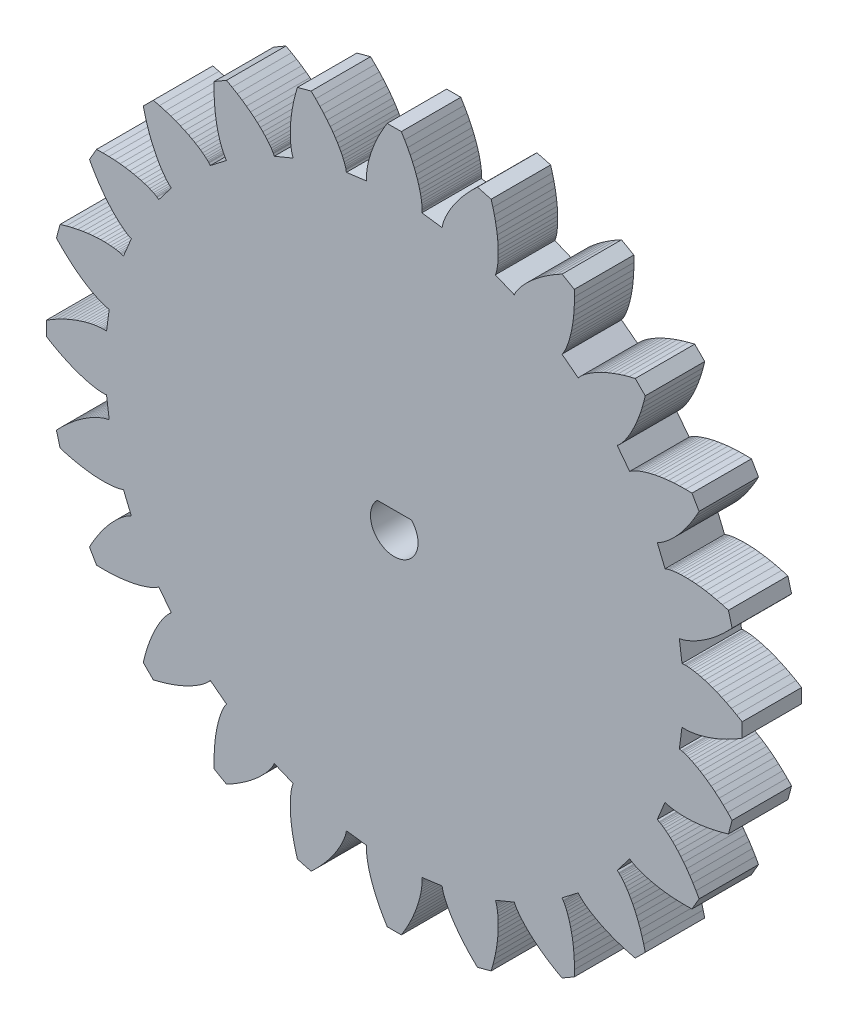
from build123d import *

# Parameters (mm, degrees)
BOSS_EXTRUDE1_DEPTH = 5
CUT_EXTRUDE1_DEPTH  = 5


with BuildPart() as part:
    # Model → Boss-Extrude1 (new body)
    with BuildSketch(Plane.XY):
        Polygon((24.189445795, 2.315321174), (24.358981209, 2.331548455), (24.373475879, 2.332600418), (24.417035513, 2.334422855), (24.489695938, 2.335012462), (24.591389407, 2.332365569), (24.721944663, 2.3244829), (24.881087201, 2.309374327), (25.068439731, 2.285063607), (25.283522858, 2.249593098), (25.525755949, 2.201028446), (25.794458213, 2.137463224), (26.088849976, 2.057023535), (26.408054153, 1.95787255), (26.751097915, 1.838214988), (27.116914554, 1.696301513), (27.504345528, 1.530433068), (27.9121427, 1.338965104), (28.338970755, 1.120311722), (28.783409797, 0.872949713), (29.24395812, 0.595422481), (29.24395812, -0.595422481), (28.783409797, -0.872949713), (28.338970755, -1.120311722), (27.9121427, -1.338965104), (27.504345528, -1.530433068), (27.116914554, -1.696301513), (26.751097915, -1.838214988), (26.408054153, -1.95787255), (26.088849976, -2.057023535), (25.794458213, -2.137463224), (25.525755949, -2.201028446), (25.283522858, -2.249593098), (25.068439731, -2.285063607), (24.881087201, -2.309374327), (24.721944663, -2.3244829), (24.591389407, -2.332365569), (24.489695938, -2.335012462), (24.417035513, -2.334422855), (24.373475879, -2.332600418), (24.358981209, -2.331548455), (24.189445795, -2.315321174), (23.964459632, -4.024260744), (24.132418196, -4.052465388), (24.146691241, -4.055200767), (24.189238298, -4.06471449), (24.25957548, -4.082950876), (24.357118762, -4.111827785), (24.481185271, -4.153232045), (24.630994771, -4.209014926), (24.805671342, -4.280987681), (25.004245246, -4.370917171), (25.225654987, -4.48052156), (25.468749554, -4.611466113), (25.732290837, -4.765359081), (26.014956232, -4.943747698), (26.315341406, -5.148114287), (26.631963235, -5.37987249), (26.963262906, -5.64036362), (27.307609171, -5.930853146), (27.663301753, -6.252527324), (28.028574902, -6.606489966), (28.401601089, -6.993759364), (28.093387733, -8.144027267), (27.57670288, -8.292899311), (27.083385732, -8.416803376), (26.614509831, -8.517535095), (26.171052456, -8.596933272), (25.753892959, -8.656875372), (25.36381131, -8.699272949), (25.001486824, -8.72606702), (24.667497103, -8.739223396), (24.362317173, -8.740727974), (24.086318826, -8.732582), (23.83977017, -8.716797315), (23.62283538, -8.695391586), (23.435574655, -8.670383535), (23.277944382, -8.643788176), (23.149797503, -8.617612063), (23.050884088, -8.593848559), (22.980852109, -8.574473141), (22.939248415, -8.561438739), (22.925519907, -8.556671124), (22.765961201, -8.497117781), (22.106335149, -10.089595943), (22.261270765, -10.160310412), (22.274349499, -10.166646721), (22.312984467, -10.186848261), (22.376205044, -10.222667859), (22.462950725, -10.27580687), (22.572073559, -10.34791109), (22.702340753, -10.440566767), (22.852437444, -10.555296733), (23.020969641, -10.693556658), (23.206467325, -10.856731426), (23.407387701, -11.046131655), (23.622118602, -11.262990351), (23.848982036, -11.50845971), (24.086237868, -11.783608081), (24.332087633, -12.089417074), (24.584678476, -12.426778848), (24.842107204, -12.796493555), (25.102424452, -13.199266966), (25.363638948, -13.635708271), (25.62372188, -14.106328066), (25.028299399, -15.137630054), (24.490689235, -15.147701526), (23.98211273, -15.139703789), (23.5031421, -15.115649145), (23.054245408, -15.07756668), (22.63578612, -15.02749748), (22.24802288, -14.967489835), (21.891109486, -14.899594442), (21.565095068, -14.825859625), (21.269924478, -14.748326558), (21.00543888, -14.669024523), (20.771376543, -14.5899662), (20.567373837, -14.513142998), (20.392966426, -14.440520434), (20.24759066, -14.374033573), (20.130585156, -14.315582537), (20.041192582, -14.267028079), (19.978561612, -14.230187253), (19.941749081, -14.206829158), (19.92972231, -14.198670797), (19.791013975, -14.099849852), (18.741700458, -15.467341852), (18.873054519, -15.575747072), (18.884047648, -15.585252502), (18.916137619, -15.614765157), (18.967933213, -15.665726921), (19.037969718, -15.739506699), (19.124712337, -15.837397095), (19.226559729, -15.960611236), (19.341847699, -16.110279756), (19.468853, -16.28744793), (19.605797266, -16.493072987), (19.750851059, -16.72802158), (19.902138022, -16.993067441), (20.057739126, -17.288889212), (20.215697023, -17.616068457), (20.374020469, -17.975087863), (20.530688836, -18.366329634), (20.683656685, -18.790074076), (20.830858408, -19.246498377), (20.970212914, -19.735675591), (21.099628369, -20.257573822), (20.257573822, -21.099628369), (19.735675591, -20.970212914), (19.246498377, -20.830858408), (18.790074076, -20.683656685), (18.366329634, -20.530688836), (17.975087863, -20.374020469), (17.616068457, -20.215697023), (17.288889212, -20.057739126), (16.993067441, -19.902138022), (16.72802158, -19.750851059), (16.493072987, -19.605797266), (16.28744793, -19.468853), (16.110279756, -19.341847699), (15.960611236, -19.226559729), (15.837397095, -19.124712337), (15.739506699, -19.037969718), (15.665726921, -18.967933213), (15.614765157, -18.916137619), (15.585252502, -18.884047648), (15.575747072, -18.873054519), (15.467341852, -18.741700458), (14.099849852, -19.791013975), (14.198670797, -19.92972231), (14.206829158, -19.941749081), (14.230187253, -19.978561612), (14.267028079, -20.041192582), (14.315582537, -20.130585156), (14.374033573, -20.24759066), (14.440520434, -20.392966426), (14.513142998, -20.567373837), (14.5899662, -20.771376543), (14.669024523, -21.00543888), (14.748326558, -21.269924478), (14.825859625, -21.565095068), (14.899594442, -21.891109486), (14.967489835, -22.24802288), (15.02749748, -22.63578612), (15.07756668, -23.054245408), (15.115649145, -23.5031421), (15.139703789, -23.98211273), (15.147701526, -24.490689235), (15.137630054, -25.028299399), (14.106328066, -25.62372188), (13.635708271, -25.363638948), (13.199266966, -25.102424452), (12.796493555, -24.842107204), (12.426778848, -24.584678476), (12.089417074, -24.332087633), (11.783608081, -24.086237868), (11.50845971, -23.848982036), (11.262990351, -23.622118602), (11.046131655, -23.407387701), (10.856731426, -23.206467325), (10.693556658, -23.020969641), (10.555296733, -22.852437444), (10.440566767, -22.702340753), (10.34791109, -22.572073559), (10.27580687, -22.462950725), (10.222667859, -22.376205044), (10.186848261, -22.312984467), (10.166646721, -22.274349499), (10.160310412, -22.261270765), (10.089595943, -22.106335149), (8.497117781, -22.765961201), (8.556671124, -22.925519907), (8.561438739, -22.939248415), (8.574473141, -22.980852109), (8.593848559, -23.050884088), (8.617612063, -23.149797503), (8.643788176, -23.277944382), (8.670383535, -23.435574655), (8.695391586, -23.62283538), (8.716797315, -23.83977017), (8.732582, -24.086318826), (8.740727974, -24.362317173), (8.739223396, -24.667497103), (8.72606702, -25.001486824), (8.699272949, -25.36381131), (8.656875372, -25.753892959), (8.596933272, -26.171052456), (8.517535095, -26.614509831), (8.416803376, -27.083385732), (8.292899311, -27.57670288), (8.144027267, -28.093387733), (6.993759364, -28.401601089), (6.606489966, -28.028574902), (6.252527324, -27.663301753), (5.930853146, -27.307609171), (5.64036362, -26.963262906), (5.37987249, -26.631963235), (5.148114287, -26.315341406), (4.943747698, -26.014956232), (4.765359081, -25.732290837), (4.611466113, -25.468749554), (4.48052156, -25.225654987), (4.370917171, -25.004245246), (4.280987681, -24.805671342), (4.209014926, -24.630994771), (4.153232045, -24.481185271), (4.111827785, -24.357118762), (4.082950876, -24.25957548), (4.06471449, -24.189238298), (4.055200767, -24.146691241), (4.052465388, -24.132418196), (4.024260744, -23.964459632), (2.315321174, -24.189445795), (2.331548455, -24.358981209), (2.332600418, -24.373475879), (2.334422855, -24.417035513), (2.335012462, -24.489695938), (2.332365569, -24.591389407), (2.3244829, -24.721944663), (2.309374327, -24.881087201), (2.285063607, -25.068439731), (2.249593098, -25.283522858), (2.201028446, -25.525755949), (2.137463224, -25.794458213), (2.057023535, -26.088849976), (1.95787255, -26.408054153), (1.838214988, -26.751097915), (1.696301513, -27.116914554), (1.530433068, -27.504345528), (1.338965104, -27.9121427), (1.120311722, -28.338970755), (0.872949713, -28.783409797), (0.595422481, -29.24395812), (-0.595422481, -29.24395812), (-0.872949713, -28.783409797), (-1.120311722, -28.338970755), (-1.338965104, -27.9121427), (-1.530433068, -27.504345528), (-1.696301513, -27.116914554), (-1.838214988, -26.751097915), (-1.95787255, -26.408054153), (-2.057023535, -26.088849976), (-2.137463224, -25.794458213), (-2.201028446, -25.525755949), (-2.249593098, -25.283522858), (-2.285063607, -25.068439731), (-2.309374327, -24.881087201), (-2.3244829, -24.721944663), (-2.332365569, -24.591389407), (-2.335012462, -24.489695938), (-2.334422855, -24.417035513), (-2.332600418, -24.373475879), (-2.331548455, -24.358981209), (-2.315321174, -24.189445795), (-4.024260744, -23.964459632), (-4.052465388, -24.132418196), (-4.055200767, -24.146691241), (-4.06471449, -24.189238298), (-4.082950876, -24.25957548), (-4.111827785, -24.357118762), (-4.153232045, -24.481185271), (-4.209014926, -24.630994771), (-4.280987681, -24.805671342), (-4.370917171, -25.004245246), (-4.48052156, -25.225654987), (-4.611466113, -25.468749554), (-4.765359081, -25.732290837), (-4.943747698, -26.014956232), (-5.148114287, -26.315341406), (-5.37987249, -26.631963235), (-5.64036362, -26.963262906), (-5.930853146, -27.307609171), (-6.252527324, -27.663301753), (-6.606489966, -28.028574902), (-6.993759364, -28.401601089), (-8.144027267, -28.093387733), (-8.292899311, -27.57670288), (-8.416803376, -27.083385732), (-8.517535095, -26.614509831), (-8.596933272, -26.171052456), (-8.656875372, -25.753892959), (-8.699272949, -25.36381131), (-8.72606702, -25.001486824), (-8.739223396, -24.667497103), (-8.740727974, -24.362317173), (-8.732582, -24.086318826), (-8.716797315, -23.83977017), (-8.695391586, -23.62283538), (-8.670383535, -23.435574655), (-8.643788176, -23.277944382), (-8.617612063, -23.149797503), (-8.593848559, -23.050884088), (-8.574473141, -22.980852109), (-8.561438739, -22.939248415), (-8.556671124, -22.925519907), (-8.497117781, -22.765961201), (-10.089595943, -22.106335149), (-10.160310412, -22.261270765), (-10.166646721, -22.274349499), (-10.186848261, -22.312984467), (-10.222667859, -22.376205044), (-10.27580687, -22.462950725), (-10.34791109, -22.572073559), (-10.440566767, -22.702340753), (-10.555296733, -22.852437444), (-10.693556658, -23.020969641), (-10.856731426, -23.206467325), (-11.046131655, -23.407387701), (-11.262990351, -23.622118602), (-11.50845971, -23.848982036), (-11.783608081, -24.086237868), (-12.089417074, -24.332087633), (-12.426778848, -24.584678476), (-12.796493555, -24.842107204), (-13.199266966, -25.102424452), (-13.635708271, -25.363638948), (-14.106328066, -25.62372188), (-15.137630054, -25.028299399), (-15.147701526, -24.490689235), (-15.139703789, -23.98211273), (-15.115649145, -23.5031421), (-15.07756668, -23.054245408), (-15.02749748, -22.63578612), (-14.967489835, -22.24802288), (-14.899594442, -21.891109486), (-14.825859625, -21.565095068), (-14.748326558, -21.269924478), (-14.669024523, -21.00543888), (-14.5899662, -20.771376543), (-14.513142998, -20.567373837), (-14.440520434, -20.392966426), (-14.374033573, -20.24759066), (-14.315582537, -20.130585156), (-14.267028079, -20.041192582), (-14.230187253, -19.978561612), (-14.206829158, -19.941749081), (-14.198670797, -19.92972231), (-14.099849852, -19.791013975), (-15.467341852, -18.741700458), (-15.575747072, -18.873054519), (-15.585252502, -18.884047648), (-15.614765157, -18.916137619), (-15.665726921, -18.967933213), (-15.739506699, -19.037969718), (-15.837397095, -19.124712337), (-15.960611236, -19.226559729), (-16.110279756, -19.341847699), (-16.28744793, -19.468853), (-16.493072987, -19.605797266), (-16.72802158, -19.750851059), (-16.993067441, -19.902138022), (-17.288889212, -20.057739126), (-17.616068457, -20.215697023), (-17.975087863, -20.374020469), (-18.366329634, -20.530688836), (-18.790074076, -20.683656685), (-19.246498377, -20.830858408), (-19.735675591, -20.970212914), (-20.257573822, -21.099628369), (-21.099628369, -20.257573822), (-20.970212914, -19.735675591), (-20.830858408, -19.246498377), (-20.683656685, -18.790074076), (-20.530688836, -18.366329634), (-20.374020469, -17.975087863), (-20.215697023, -17.616068457), (-20.057739126, -17.288889212), (-19.902138022, -16.993067441), (-19.750851059, -16.72802158), (-19.605797266, -16.493072987), (-19.468853, -16.28744793), (-19.341847699, -16.110279756), (-19.226559729, -15.960611236), (-19.124712337, -15.837397095), (-19.037969718, -15.739506699), (-18.967933213, -15.665726921), (-18.916137619, -15.614765157), (-18.884047648, -15.585252502), (-18.873054519, -15.575747072), (-18.741700458, -15.467341852), (-19.791013975, -14.099849852), (-19.92972231, -14.198670797), (-19.941749081, -14.206829158), (-19.978561612, -14.230187253), (-20.041192582, -14.267028079), (-20.130585156, -14.315582537), (-20.24759066, -14.374033573), (-20.392966426, -14.440520434), (-20.567373837, -14.513142998), (-20.771376543, -14.5899662), (-21.00543888, -14.669024523), (-21.269924478, -14.748326558), (-21.565095068, -14.825859625), (-21.891109486, -14.899594442), (-22.24802288, -14.967489835), (-22.63578612, -15.02749748), (-23.054245408, -15.07756668), (-23.5031421, -15.115649145), (-23.98211273, -15.139703789), (-24.490689235, -15.147701526), (-25.028299399, -15.137630054), (-25.62372188, -14.106328066), (-25.363638948, -13.635708271), (-25.102424452, -13.199266966), (-24.842107204, -12.796493555), (-24.584678476, -12.426778848), (-24.332087633, -12.089417074), (-24.086237868, -11.783608081), (-23.848982036, -11.50845971), (-23.622118602, -11.262990351), (-23.407387701, -11.046131655), (-23.206467325, -10.856731426), (-23.020969641, -10.693556658), (-22.852437444, -10.555296733), (-22.702340753, -10.440566767), (-22.572073559, -10.34791109), (-22.462950725, -10.27580687), (-22.376205044, -10.222667859), (-22.312984467, -10.186848261), (-22.274349499, -10.166646721), (-22.261270765, -10.160310412), (-22.106335149, -10.089595943), (-22.765961201, -8.497117781), (-22.925519907, -8.556671124), (-22.939248415, -8.561438739), (-22.980852109, -8.574473141), (-23.050884088, -8.593848559), (-23.149797503, -8.617612063), (-23.277944382, -8.643788176), (-23.435574655, -8.670383535), (-23.62283538, -8.695391586), (-23.83977017, -8.716797315), (-24.086318826, -8.732582), (-24.362317173, -8.740727974), (-24.667497103, -8.739223396), (-25.001486824, -8.72606702), (-25.36381131, -8.699272949), (-25.753892959, -8.656875372), (-26.171052456, -8.596933272), (-26.614509831, -8.517535095), (-27.083385732, -8.416803376), (-27.57670288, -8.292899311), (-28.093387733, -8.144027267), (-28.401601089, -6.993759364), (-28.028574902, -6.606489966), (-27.663301753, -6.252527324), (-27.307609171, -5.930853146), (-26.963262906, -5.64036362), (-26.631963235, -5.37987249), (-26.315341406, -5.148114287), (-26.014956232, -4.943747698), (-25.732290837, -4.765359081), (-25.468749554, -4.611466113), (-25.225654987, -4.48052156), (-25.004245246, -4.370917171), (-24.805671342, -4.280987681), (-24.630994771, -4.209014926), (-24.481185271, -4.153232045), (-24.357118762, -4.111827785), (-24.25957548, -4.082950876), (-24.189238298, -4.06471449), (-24.146691241, -4.055200767), (-24.132418196, -4.052465388), (-23.964459632, -4.024260744), (-24.189445795, -2.315321174), (-24.358981209, -2.331548455), (-24.373475879, -2.332600418), (-24.417035513, -2.334422855), (-24.489695938, -2.335012462), (-24.591389407, -2.332365569), (-24.721944663, -2.3244829), (-24.881087201, -2.309374327), (-25.068439731, -2.285063607), (-25.283522858, -2.249593098), (-25.525755949, -2.201028446), (-25.794458213, -2.137463224), (-26.088849976, -2.057023535), (-26.408054153, -1.95787255), (-26.751097915, -1.838214988), (-27.116914554, -1.696301513), (-27.504345528, -1.530433068), (-27.9121427, -1.338965104), (-28.338970755, -1.120311722), (-28.783409797, -0.872949713), (-29.24395812, -0.595422481), (-29.24395812, 0.595422481), (-28.783409797, 0.872949713), (-28.338970755, 1.120311722), (-27.9121427, 1.338965104), (-27.504345528, 1.530433068), (-27.116914554, 1.696301513), (-26.751097915, 1.838214988), (-26.408054153, 1.95787255), (-26.088849976, 2.057023535), (-25.794458213, 2.137463224), (-25.525755949, 2.201028446), (-25.283522858, 2.249593098), (-25.068439731, 2.285063607), (-24.881087201, 2.309374327), (-24.721944663, 2.3244829), (-24.591389407, 2.332365569), (-24.489695938, 2.335012462), (-24.417035513, 2.334422855), (-24.373475879, 2.332600418), (-24.358981209, 2.331548455), (-24.189445795, 2.315321174), (-23.964459632, 4.024260744), (-24.132418196, 4.052465388), (-24.146691241, 4.055200767), (-24.189238298, 4.06471449), (-24.25957548, 4.082950876), (-24.357118762, 4.111827785), (-24.481185271, 4.153232045), (-24.630994771, 4.209014926), (-24.805671342, 4.280987681), (-25.004245246, 4.370917171), (-25.225654987, 4.48052156), (-25.468749554, 4.611466113), (-25.732290837, 4.765359081), (-26.014956232, 4.943747698), (-26.315341406, 5.148114287), (-26.631963235, 5.37987249), (-26.963262906, 5.64036362), (-27.307609171, 5.930853146), (-27.663301753, 6.252527324), (-28.028574902, 6.606489966), (-28.401601089, 6.993759364), (-28.093387733, 8.144027267), (-27.57670288, 8.292899311), (-27.083385732, 8.416803376), (-26.614509831, 8.517535095), (-26.171052456, 8.596933272), (-25.753892959, 8.656875372), (-25.36381131, 8.699272949), (-25.001486824, 8.72606702), (-24.667497103, 8.739223396), (-24.362317173, 8.740727974), (-24.086318826, 8.732582), (-23.83977017, 8.716797315), (-23.62283538, 8.695391586), (-23.435574655, 8.670383535), (-23.277944382, 8.643788176), (-23.149797503, 8.617612063), (-23.050884088, 8.593848559), (-22.980852109, 8.574473141), (-22.939248415, 8.561438739), (-22.925519907, 8.556671124), (-22.765961201, 8.497117781), (-22.106335149, 10.089595943), (-22.261270765, 10.160310412), (-22.274349499, 10.166646721), (-22.312984467, 10.186848261), (-22.376205044, 10.222667859), (-22.462950725, 10.27580687), (-22.572073559, 10.34791109), (-22.702340753, 10.440566767), (-22.852437444, 10.555296733), (-23.020969641, 10.693556658), (-23.206467325, 10.856731426), (-23.407387701, 11.046131655), (-23.622118602, 11.262990351), (-23.848982036, 11.50845971), (-24.086237868, 11.783608081), (-24.332087633, 12.089417074), (-24.584678476, 12.426778848), (-24.842107204, 12.796493555), (-25.102424452, 13.199266966), (-25.363638948, 13.635708271), (-25.62372188, 14.106328066), (-25.028299399, 15.137630054), (-24.490689235, 15.147701526), (-23.98211273, 15.139703789), (-23.5031421, 15.115649145), (-23.054245408, 15.07756668), (-22.63578612, 15.02749748), (-22.24802288, 14.967489835), (-21.891109486, 14.899594442), (-21.565095068, 14.825859625), (-21.269924478, 14.748326558), (-21.00543888, 14.669024523), (-20.771376543, 14.5899662), (-20.567373837, 14.513142998), (-20.392966426, 14.440520434), (-20.24759066, 14.374033573), (-20.130585156, 14.315582537), (-20.041192582, 14.267028079), (-19.978561612, 14.230187253), (-19.941749081, 14.206829158), (-19.92972231, 14.198670797), (-19.791013975, 14.099849852), (-18.741700458, 15.467341852), (-18.873054519, 15.575747072), (-18.884047648, 15.585252502), (-18.916137619, 15.614765157), (-18.967933213, 15.665726921), (-19.037969718, 15.739506699), (-19.124712337, 15.837397095), (-19.226559729, 15.960611236), (-19.341847699, 16.110279756), (-19.468853, 16.28744793), (-19.605797266, 16.493072987), (-19.750851059, 16.72802158), (-19.902138022, 16.993067441), (-20.057739126, 17.288889212), (-20.215697023, 17.616068457), (-20.374020469, 17.975087863), (-20.530688836, 18.366329634), (-20.683656685, 18.790074076), (-20.830858408, 19.246498377), (-20.970212914, 19.735675591), (-21.099628369, 20.257573822), (-20.257573822, 21.099628369), (-19.735675591, 20.970212914), (-19.246498377, 20.830858408), (-18.790074076, 20.683656685), (-18.366329634, 20.530688836), (-17.975087863, 20.374020469), (-17.616068457, 20.215697023), (-17.288889212, 20.057739126), (-16.993067441, 19.902138022), (-16.72802158, 19.750851059), (-16.493072987, 19.605797266), (-16.28744793, 19.468853), (-16.110279756, 19.341847699), (-15.960611236, 19.226559729), (-15.837397095, 19.124712337), (-15.739506699, 19.037969718), (-15.665726921, 18.967933213), (-15.614765157, 18.916137619), (-15.585252502, 18.884047648), (-15.575747072, 18.873054519), (-15.467341852, 18.741700458), (-14.099849852, 19.791013975), (-14.198670797, 19.92972231), (-14.206829158, 19.941749081), (-14.230187253, 19.978561612), (-14.267028079, 20.041192582), (-14.315582537, 20.130585156), (-14.374033573, 20.24759066), (-14.440520434, 20.392966426), (-14.513142998, 20.567373837), (-14.5899662, 20.771376543), (-14.669024523, 21.00543888), (-14.748326558, 21.269924478), (-14.825859625, 21.565095068), (-14.899594442, 21.891109486), (-14.967489835, 22.24802288), (-15.02749748, 22.63578612), (-15.07756668, 23.054245408), (-15.115649145, 23.5031421), (-15.139703789, 23.98211273), (-15.147701526, 24.490689235), (-15.137630054, 25.028299399), (-14.106328066, 25.62372188), (-13.635708271, 25.363638948), (-13.199266966, 25.102424452), (-12.796493555, 24.842107204), (-12.426778848, 24.584678476), (-12.089417074, 24.332087633), (-11.783608081, 24.086237868), (-11.50845971, 23.848982036), (-11.262990351, 23.622118602), (-11.046131655, 23.407387701), (-10.856731426, 23.206467325), (-10.693556658, 23.020969641), (-10.555296733, 22.852437444), (-10.440566767, 22.702340753), (-10.34791109, 22.572073559), (-10.27580687, 22.462950725), (-10.222667859, 22.376205044), (-10.186848261, 22.312984467), (-10.166646721, 22.274349499), (-10.160310412, 22.261270765), (-10.089595943, 22.106335149), (-8.497117781, 22.765961201), (-8.556671124, 22.925519907), (-8.561438739, 22.939248415), (-8.574473141, 22.980852109), (-8.593848559, 23.050884088), (-8.617612063, 23.149797503), (-8.643788176, 23.277944382), (-8.670383535, 23.435574655), (-8.695391586, 23.62283538), (-8.716797315, 23.83977017), (-8.732582, 24.086318826), (-8.740727974, 24.362317173), (-8.739223396, 24.667497103), (-8.72606702, 25.001486824), (-8.699272949, 25.36381131), (-8.656875372, 25.753892959), (-8.596933272, 26.171052456), (-8.517535095, 26.614509831), (-8.416803376, 27.083385732), (-8.292899311, 27.57670288), (-8.144027267, 28.093387733), (-6.993759364, 28.401601089), (-6.606489966, 28.028574902), (-6.252527324, 27.663301753), (-5.930853146, 27.307609171), (-5.64036362, 26.963262906), (-5.37987249, 26.631963235), (-5.148114287, 26.315341406), (-4.943747698, 26.014956232), (-4.765359081, 25.732290837), (-4.611466113, 25.468749554), (-4.48052156, 25.225654987), (-4.370917171, 25.004245246), (-4.280987681, 24.805671342), (-4.209014926, 24.630994771), (-4.153232045, 24.481185271), (-4.111827785, 24.357118762), (-4.082950876, 24.25957548), (-4.06471449, 24.189238298), (-4.055200767, 24.146691241), (-4.052465388, 24.132418196), (-4.024260744, 23.964459632), (-2.315321174, 24.189445795), (-2.331548455, 24.358981209), (-2.332600418, 24.373475879), (-2.334422855, 24.417035513), (-2.335012462, 24.489695938), (-2.332365569, 24.591389407), (-2.3244829, 24.721944663), (-2.309374327, 24.881087201), (-2.285063607, 25.068439731), (-2.249593098, 25.283522858), (-2.201028446, 25.525755949), (-2.137463224, 25.794458213), (-2.057023535, 26.088849976), (-1.95787255, 26.408054153), (-1.838214988, 26.751097915), (-1.696301513, 27.116914554), (-1.530433068, 27.504345528), (-1.338965104, 27.9121427), (-1.120311722, 28.338970755), (-0.872949713, 28.783409797), (-0.595422481, 29.24395812), (0.595422481, 29.24395812), (0.872949713, 28.783409797), (1.120311722, 28.338970755), (1.338965104, 27.9121427), (1.530433068, 27.504345528), (1.696301513, 27.116914554), (1.838214988, 26.751097915), (1.95787255, 26.408054153), (2.057023535, 26.088849976), (2.137463223, 25.794458213), (2.201028446, 25.525755949), (2.249593098, 25.283522858), (2.285063607, 25.068439731), (2.309374327, 24.881087201), (2.3244829, 24.721944663), (2.332365569, 24.591389407), (2.335012462, 24.489695938), (2.334422855, 24.417035513), (2.332600418, 24.373475879), (2.331548455, 24.358981209), (2.315321174, 24.189445795), (4.024260744, 23.964459632), (4.052465388, 24.132418196), (4.055200767, 24.146691241), (4.06471449, 24.189238298), (4.082950876, 24.25957548), (4.111827785, 24.357118762), (4.153232045, 24.481185271), (4.209014926, 24.630994771), (4.280987681, 24.805671342), (4.370917171, 25.004245246), (4.48052156, 25.225654987), (4.611466113, 25.468749554), (4.765359081, 25.732290837), (4.943747698, 26.014956232), (5.148114287, 26.315341406), (5.37987249, 26.631963235), (5.64036362, 26.963262906), (5.930853146, 27.307609171), (6.252527324, 27.663301753), (6.606489966, 28.028574902), (6.993759364, 28.401601089), (8.144027267, 28.093387733), (8.292899311, 27.57670288), (8.416803376, 27.083385732), (8.517535095, 26.614509831), (8.596933272, 26.171052456), (8.656875372, 25.753892959), (8.699272949, 25.36381131), (8.72606702, 25.001486824), (8.739223396, 24.667497103), (8.740727974, 24.362317173), (8.732582, 24.086318826), (8.716797315, 23.83977017), (8.695391586, 23.62283538), (8.670383535, 23.435574655), (8.643788176, 23.277944382), (8.617612063, 23.149797503), (8.593848559, 23.050884088), (8.574473141, 22.980852109), (8.561438739, 22.939248415), (8.556671124, 22.925519907), (8.497117781, 22.765961201), (10.089595943, 22.106335149), (10.160310412, 22.261270765), (10.166646721, 22.274349499), (10.186848261, 22.312984467), (10.222667859, 22.376205044), (10.27580687, 22.462950725), (10.34791109, 22.572073559), (10.440566767, 22.702340753), (10.555296733, 22.852437444), (10.693556658, 23.020969641), (10.856731426, 23.206467325), (11.046131655, 23.407387701), (11.262990351, 23.622118602), (11.50845971, 23.848982036), (11.783608081, 24.086237868), (12.089417074, 24.332087633), (12.426778848, 24.584678476), (12.796493555, 24.842107204), (13.199266966, 25.102424452), (13.635708271, 25.363638948), (14.106328066, 25.62372188), (15.137630054, 25.028299399), (15.147701526, 24.490689235), (15.139703789, 23.98211273), (15.115649145, 23.5031421), (15.07756668, 23.054245408), (15.02749748, 22.63578612), (14.967489835, 22.24802288), (14.899594442, 21.891109486), (14.825859625, 21.565095068), (14.748326558, 21.269924478), (14.669024523, 21.00543888), (14.5899662, 20.771376543), (14.513142998, 20.567373837), (14.440520434, 20.392966426), (14.374033573, 20.24759066), (14.315582537, 20.130585156), (14.267028079, 20.041192582), (14.230187253, 19.978561612), (14.206829158, 19.941749081), (14.198670797, 19.92972231), (14.099849852, 19.791013975), (15.467341852, 18.741700458), (15.575747072, 18.873054519), (15.585252502, 18.884047648), (15.614765157, 18.916137619), (15.665726921, 18.967933213), (15.739506699, 19.037969718), (15.837397095, 19.124712337), (15.960611236, 19.226559729), (16.110279756, 19.341847699), (16.28744793, 19.468853), (16.493072987, 19.605797266), (16.72802158, 19.750851059), (16.993067441, 19.902138022), (17.288889212, 20.057739126), (17.616068457, 20.215697023), (17.975087863, 20.374020469), (18.366329634, 20.530688836), (18.790074076, 20.683656685), (19.246498377, 20.830858408), (19.735675591, 20.970212914), (20.257573822, 21.099628369), (21.099628369, 20.257573822), (20.970212914, 19.735675591), (20.830858408, 19.246498377), (20.683656685, 18.790074076), (20.530688836, 18.366329634), (20.374020469, 17.975087863), (20.215697023, 17.616068457), (20.057739126, 17.288889212), (19.902138022, 16.993067441), (19.750851059, 16.72802158), (19.605797266, 16.493072987), (19.468853, 16.28744793), (19.341847699, 16.110279756), (19.226559729, 15.960611236), (19.124712337, 15.837397095), (19.037969718, 15.739506699), (18.967933213, 15.665726921), (18.916137619, 15.614765157), (18.884047648, 15.585252502), (18.873054519, 15.575747072), (18.741700458, 15.467341852), (19.791013975, 14.099849852), (19.92972231, 14.198670797), (19.941749081, 14.206829158), (19.978561612, 14.230187253), (20.041192582, 14.267028079), (20.130585156, 14.315582537), (20.24759066, 14.374033573), (20.392966426, 14.440520434), (20.567373837, 14.513142998), (20.771376543, 14.5899662), (21.00543888, 14.669024523), (21.269924478, 14.748326558), (21.565095068, 14.825859625), (21.891109486, 14.899594442), (22.24802288, 14.967489835), (22.63578612, 15.02749748), (23.054245408, 15.07756668), (23.5031421, 15.115649145), (23.98211273, 15.139703789), (24.490689235, 15.147701526), (25.028299399, 15.137630054), (25.62372188, 14.106328066), (25.363638948, 13.635708271), (25.102424452, 13.199266966), (24.842107204, 12.796493555), (24.584678476, 12.426778848), (24.332087633, 12.089417074), (24.086237868, 11.783608081), (23.848982036, 11.50845971), (23.622118602, 11.262990351), (23.407387701, 11.046131655), (23.206467325, 10.856731426), (23.020969641, 10.693556658), (22.852437444, 10.555296733), (22.702340753, 10.440566767), (22.572073559, 10.34791109), (22.462950725, 10.27580687), (22.376205044, 10.222667859), (22.312984467, 10.186848261), (22.274349499, 10.166646721), (22.261270765, 10.160310412), (22.106335149, 10.089595943), (22.765961201, 8.497117781), (22.925519907, 8.556671124), (22.939248415, 8.561438739), (22.980852109, 8.574473141), (23.050884088, 8.593848559), (23.149797503, 8.617612063), (23.277944382, 8.643788176), (23.435574655, 8.670383535), (23.62283538, 8.695391586), (23.83977017, 8.716797315), (24.086318826, 8.732582), (24.362317173, 8.740727974), (24.667497103, 8.739223396), (25.001486824, 8.72606702), (25.36381131, 8.699272949), (25.753892959, 8.656875372), (26.171052456, 8.596933272), (26.614509831, 8.517535095), (27.083385732, 8.416803376), (27.57670288, 8.292899311), (28.093387733, 8.144027267), (28.401601089, 6.993759364), (28.028574902, 6.606489966), (27.663301753, 6.252527324), (27.307609171, 5.930853146), (26.963262906, 5.64036362), (26.631963235, 5.37987249), (26.315341406, 5.148114287), (26.014956232, 4.943747698), (25.732290837, 4.765359081), (25.468749554, 4.611466113), (25.225654987, 4.48052156), (25.004245246, 4.370917171), (24.805671342, 4.280987681), (24.630994771, 4.209014926), (24.481185271, 4.153232045), (24.357118762, 4.111827785), (24.25957548, 4.082950876), (24.189238298, 4.06471449), (24.146691241, 4.055200767), (24.132418196, 4.052465388), (23.964459632, 4.024260744), align=None)
    extrude(amount=BOSS_EXTRUDE1_DEPTH)

    # Sketch2 → Cut-Extrude1 (cut)
    with BuildSketch(Plane.XY.offset(5)):
        with BuildLine():
            Line((-1.438019471, 1.39), (1.438019471, 1.39))
            ThreePointArc((1.438019471, 1.39), (0, -2), (-1.438019471, 1.39))
        make_face()
    extrude(amount=-CUT_EXTRUDE1_DEPTH, mode=Mode.SUBTRACT)


solid = part.part
